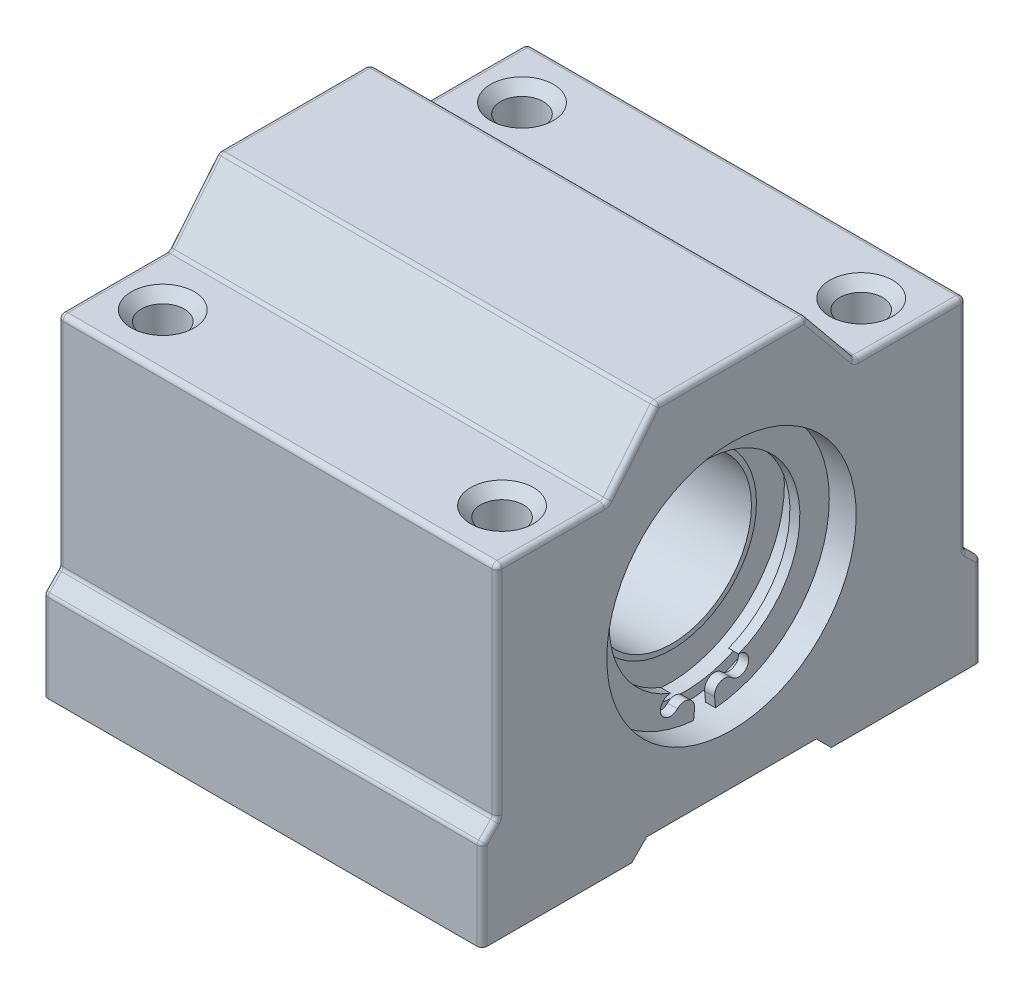
from build123d import *

# Parameters (mm, degrees)
SKETCH1_R           = 12.5
BOSS_EXTRUDE1_DEPTH = 44
EXTRUDE_THIN1_START = 0.5
SKETCH1_4_R         = 8.5
SKETCH1_4_R_2       = 8
EXTRUDE_THIN1_DEPTH = 37.5
BOSS_EXTRUDE2_START = 0.8
SKETCH1_5_R         = 11.5
SKETCH1_5_R_2       = 8
BOSS_EXTRUDE2_DEPTH = 37
BOSS_EXTRUDE3_START = 0.3
SKETCH1_6_R         = 12.5
SKETCH1_6_R_2       = 11.5
BOSS_EXTRUDE3_DEPTH = 39
BOSS_EXTRUDE4_START = 1
BOSS_EXTRUDE4_DEPTH = 1
FILLET1_R           = 0.5
SKETCH4_R           = 2.15
CUT_EXTRUDE3_DEPTH  = 64.647152332
CHAMFER1_SIZE       = 1


with BuildPart() as part:
    # Sketch1 → Boss-Extrude1 (new body)
    with BuildSketch(Plane(origin=(0, 0, 0), x_dir=(0, 0, -1), z_dir=(1, 0, 0))):
        Polygon((-25, -19), (-10, -19), (-8.5, -17.5), (8.5, -17.5), (10, -19), (25, -19), (25, -10), (23.5, -8.5), (23.5, 13.5), (12.5, 13.5), (7.5, 19.6), (-7.5, 19.6), (-12.5, 13.5), (-23.5, 13.5), (-23.5, -8.5), (-25, -10), align=None)
        Circle(SKETCH1_R, mode=Mode.SUBTRACT)
    extrude(amount=BOSS_EXTRUDE1_DEPTH)



with BuildPart() as body_2:
    # Sketch1<4> → Extrude-Thin1 (new body)
    with BuildSketch(Plane(origin=(0, 0, 0), x_dir=(0, 0, -1), z_dir=(1, 0, 0)).offset(EXTRUDE_THIN1_START)):
        Circle(SKETCH1_4_R)
        Circle(SKETCH1_4_R_2, mode=Mode.SUBTRACT)
    extrude(amount=EXTRUDE_THIN1_DEPTH)

    # Sketch1<5> → Boss-Extrude2 (add)
    with BuildSketch(Plane(origin=(0, 0, 0), x_dir=(0, 0, -1), z_dir=(1, 0, 0)).offset(BOSS_EXTRUDE2_START)):
        Circle(SKETCH1_5_R)
        Circle(SKETCH1_5_R_2, mode=Mode.SUBTRACT)
    extrude(amount=BOSS_EXTRUDE2_DEPTH)


with BuildPart() as part_1:
    add(part.part)

    add(body_2.part)  # Boss-Extrude3 merges body 2
    # Sketch1<6> → Boss-Extrude3 (add)
    with BuildSketch(Plane(origin=(0, 0, 0), x_dir=(0, 0, -1), z_dir=(1, 0, 0)).offset(BOSS_EXTRUDE3_START)):
        Circle(SKETCH1_6_R)
        Circle(SKETCH1_6_R_2, mode=Mode.SUBTRACT)
    extrude(amount=BOSS_EXTRUDE3_DEPTH)

    # Sketch3 → Boss-Extrude4 (add)
    with BuildSketch(Plane(origin=(39.3, 0, 0), x_dir=(0, 0, -1), z_dir=(1, 0, 0)).offset(BOSS_EXTRUDE4_START)):
        with BuildLine():
            Line((-1.008608766, -11.455684543), (-1.096313876, -12.451831025))
            ThreePointArc((-1.096313876, -12.451831025), (0, 12.5), (1.096313876, -12.451831025))
            Line((1.096313876, -12.451831025), (1.008608766, -11.455684543))
            ThreePointArc((1.008608766, -11.455684543), (1.561971623, -10.425790507), (2.714072041, -10.624679428))
            ThreePointArc((2.714072041, -10.624679428), (4.353799231, -10.302975473), (3.408913328, -8.924792132))
            ThreePointArc((3.408913328, -8.924792132), (0, 9.553669697), (-3.408913328, -8.924792132))
            ThreePointArc((-3.408913328, -8.924792132), (-4.353799231, -10.302975473), (-2.714072041, -10.624679428))
            ThreePointArc((-2.714072041, -10.624679428), (-1.561971623, -10.425790507), (-1.008608766, -11.455684543))
        make_face()
    extrude(amount=BOSS_EXTRUDE4_DEPTH)

    # Fillet1
    fillet1_edges = [part_1.edges().sort_by_distance(p)[0] for p in [
        (22, -8.5, -23.5),
        (22, -8.5, 23.5),
        (22, -10, 25),
        (22, -10, -25),
        (22, 13.5, -12.5),
        (22, 13.5, 12.5),
        (22, 19.6, 7.5),
        (22, 19.6, -7.5),
        (22, 13.5, -23.5),
        (22, 13.5, 23.5),
        (44, 16.55, -10),
        (44, 16.55, 10),
        (44, 2.5, 23.5),
        (0, -9.25, 24.25),
        (0, 16.55, 10),
        (44, -9.25, -24.25),
        (44, -14.5, -25),
        (44, 2.5, -23.5),
        (44, 19.6, 0),
        (44, 13.5, -18),
        (44, 13.5, 18),
        (44, -9.25, 24.25),
        (44, -14.5, 25),
        (0, -14.5, -25),
        (0, -9.25, -24.25),
        (0, 2.5, -23.5),
        (0, 16.55, -10),
        (0, 13.5, -18),
        (0, 19.6, 0),
        (0, -14.5, 25),
        (0, 2.5, 23.5),
        (0, 13.5, 18),
    ]]
    fillet(fillet1_edges, radius=FILLET1_R)

    # Sketch4 → Cut-Extrude3 (cut, through all)
    with BuildSketch(Plane.XZ.offset(19)):
        with Locations((5, 18)):
            Circle(SKETCH4_R)
        with Locations((39, 18)):
            Circle(SKETCH4_R)
        with Locations((39, -18)):
            Circle(SKETCH4_R)
        with Locations((5, -18)):
            Circle(SKETCH4_R)
    extrude(amount=-CUT_EXTRUDE3_DEPTH, mode=Mode.SUBTRACT)

    # Chamfer1
    chamfer1_edges = [part_1.edges().sort_by_distance(p)[0] for p in [
        (36.85, 13.5, -18),
        (2.85, 13.5, -18),
        (2.85, 13.5, 18),
        (36.85, 13.5, 18),
        (36.85, -19, 18),
        (2.85, -19, 18),
    ]]
    chamfer(chamfer1_edges, length=CHAMFER1_SIZE)


solid = part_1.part
